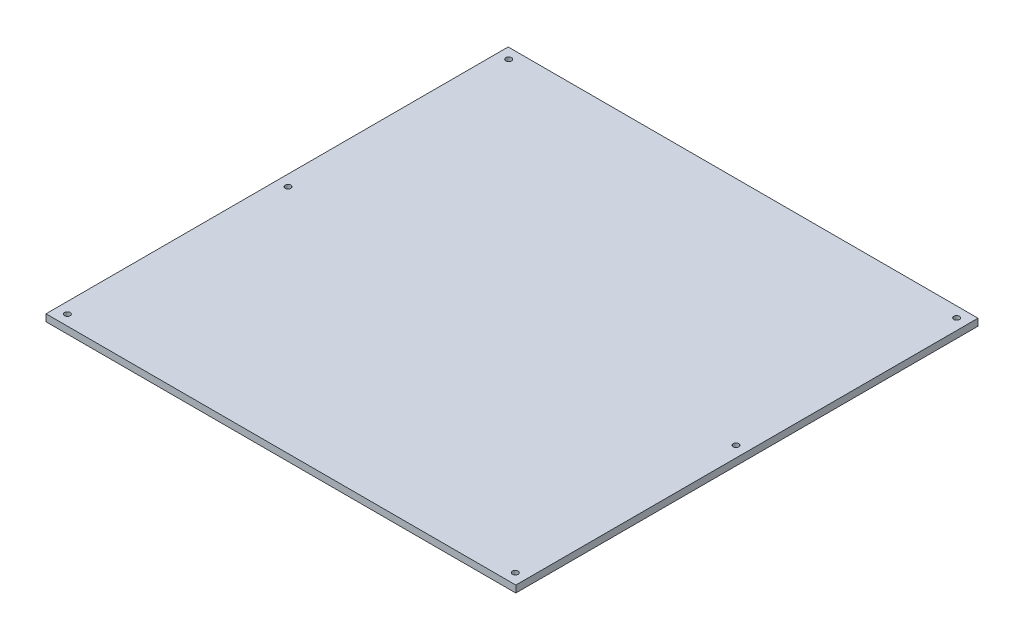
from build123d import *

# Parameters (mm, degrees)
SKETCH2_W           = 429.26
SKETCH2_H           = 422.275
SKETCH2_R           = 2.6
BOSS_EXTRUDE1_DEPTH = 3.175


with BuildPart() as part:
    # Sketch2 → Boss-Extrude1 (new, symmetric)
    with BuildSketch(Plane(origin=(0, 0, 0), x_dir=(1, 0, 0), z_dir=(0, 1, 0))):
        Rectangle(SKETCH2_W, SKETCH2_H)
        with Locations((-204.63, 201.6125)):
            Circle(SKETCH2_R, mode=Mode.SUBTRACT)
        with Locations((204.63, 201.6125)):
            Circle(SKETCH2_R, mode=Mode.SUBTRACT)
        with Locations((204.63, -201.6125)):
            Circle(SKETCH2_R, mode=Mode.SUBTRACT)
        with Locations((-204.63, -201.6125)):
            Circle(SKETCH2_R, mode=Mode.SUBTRACT)
        with Locations((-204.63, 0)):
            Circle(SKETCH2_R, mode=Mode.SUBTRACT)
        with Locations((204.63, 0)):
            Circle(SKETCH2_R, mode=Mode.SUBTRACT)
    extrude(amount=BOSS_EXTRUDE1_DEPTH, both=True)


solid = part.part
